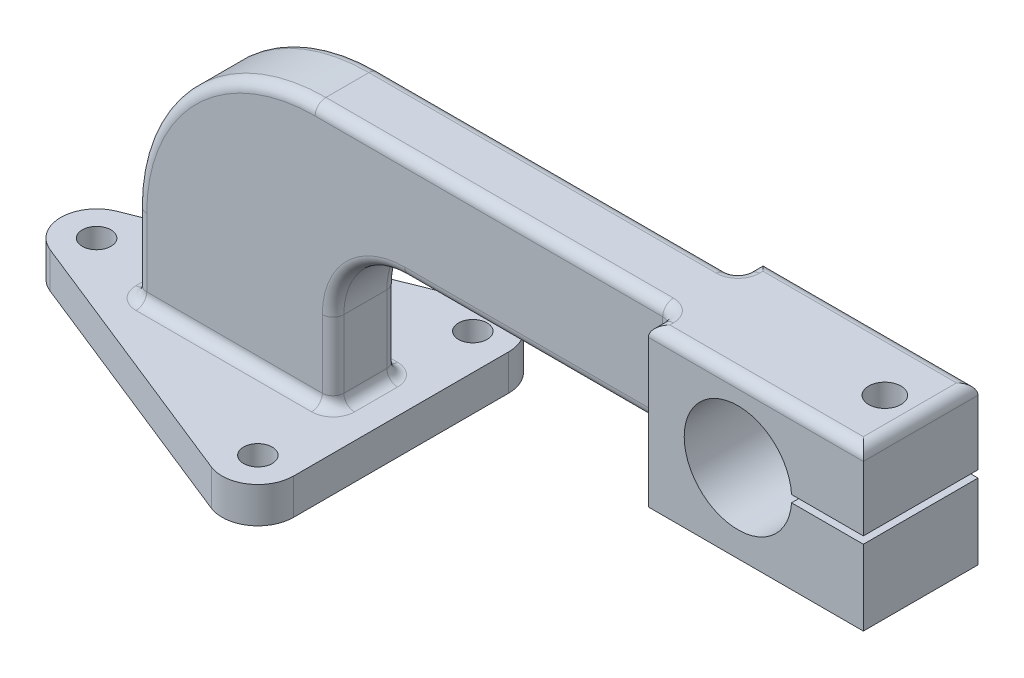
from build123d import *

# Parameters (mm, degrees)
BOSS_EXTRUDE1_DEPTH = 9
SKETCH3_R           = 4
SKETCH3_W           = 55
SKETCH3_H           = 18
BOSS_EXTRUDE2_DEPTH = 10
SKETCH4_W           = 32
SKETCH4_H           = 44
BOSS_EXTRUDE3_DEPTH = 60
SKETCH5_R           = 15
CUT_EXTRUDE1_DEPTH  = 60
SKETCH6_W           = 54.078900839
SKETCH6_H           = 2
CUT_EXTRUDE2_DEPTH  = 60
SKETCH7_R           = 4.5
CUT_EXTRUDE3_DEPTH  = 170.204757616
FILLET1_R           = 3


with BuildPart() as part:
    # Sketch1 → Boss-Extrude1 (new, symmetric)
    with BuildSketch(Plane.XY):
        with BuildLine():
            Line((-112.5, 7.686316473), (-57.5, 7.686316473))
            Line((-57.5, 7.686316473), (-57.5, 29.686316473))
            ThreePointArc((-57.5, 29.686316473), (-51.642135624, 43.828452097), (-37.5, 49.686316473))
            Line((-37.5, 49.686316473), (37.5, 49.686316473))
            Line((37.5, 49.686316473), (37.5, 79.686316473))
            Line((37.5, 79.686316473), (-62.5, 79.686316473))
            ThreePointArc((-62.5, 79.686316473), (-97.855339059, 65.041655533), (-112.5, 29.686316473))
            Line((-112.5, 29.686316473), (-112.5, 7.686316473))
        make_face()
    extrude(amount=BOSS_EXTRUDE1_DEPTH, both=True)

    # Sketch3 → Boss-Extrude2 (add)
    # profile 1 of 2: a face of its own
    with BuildSketch(Plane.XZ.offset(-7.686316473)):
        with BuildLine():
            ThreePointArc((-136.213906764, -9.284766909), (-142.5, 0), (-136.213906764, 9.284766909))
            Line((-136.213906764, 9.284766909), (-61.213906764, 39.284766909))
            ThreePointArc((-61.213906764, 39.284766909), (-51.893711907, 38.280672305), (-47.5, 30))
            Line((-47.5, 30), (-47.5, -30))
            ThreePointArc((-47.5, -30), (-51.893711907, -38.280672305), (-61.213906764, -39.284766909))
            Line((-61.213906764, -39.284766909), (-136.213906764, -9.284766909))
        make_face()
        with Locations(Location((-57.5, 30, 0), (0, 0, 270))):
            Circle(SKETCH3_R, mode=Mode.SUBTRACT)
        with Locations(Location((-57.5, -30, 0), (0, 0, 270))):
            Circle(SKETCH3_R, mode=Mode.SUBTRACT)
        with Locations(Location((-132.5, 0, 0), (0, 0, 270))):
            Circle(SKETCH3_R, mode=Mode.SUBTRACT)
        with Locations((-85, 0)):
            Rectangle(SKETCH3_W, SKETCH3_H, mode=Mode.SUBTRACT)
    # profile 2 of 2: a face of its own
    with BuildSketch(Plane.XZ.offset(-7.686316473)):
        with Locations((-85, 0)):
            Rectangle(SKETCH3_W, SKETCH3_H)
    extrude(amount=BOSS_EXTRUDE2_DEPTH)

    # Sketch4 → Boss-Extrude3 (add)
    with BuildSketch(Plane(origin=(37.5, 0, 0), x_dir=(0, 0, -1), z_dir=(1, 0, 0))):
        with Locations((0, 57.686316473)):
            Rectangle(SKETCH4_W, SKETCH4_H)
    extrude(amount=BOSS_EXTRUDE3_DEPTH)

    # Sketch5 → Cut-Extrude1 (cut)
    with BuildSketch(Plane.XY.offset(16)):
        with Locations((62.5, 57.686316473)):
            Circle(SKETCH5_R)
    extrude(amount=-CUT_EXTRUDE1_DEPTH, mode=Mode.SUBTRACT)

    # Sketch6 → Cut-Extrude2 (cut)
    with BuildSketch(Plane.XY.offset(16)):
        with Locations((94.351130384, 57.686316473)):
            Rectangle(SKETCH6_W, SKETCH6_H)
    extrude(amount=-CUT_EXTRUDE2_DEPTH, mode=Mode.SUBTRACT)

    # Sketch7 → Cut-Extrude3 (cut, through all)
    with BuildSketch(Plane(origin=(0, 79.686316473, 0), x_dir=(1, 0, 0), z_dir=(0, 1, 0))):
        with Locations(Location((87.5, 0, 0), (0, 0, 270))):
            Circle(SKETCH7_R)
    extrude(amount=-CUT_EXTRUDE3_DEPTH, mode=Mode.SUBTRACT)

    # Fillet1
    fillet1_edges = [part.edges().sort_by_distance(p)[0] for p in [
        (-57.5, 18.686316473, 9),
        (-85, 7.686316473, -9),
        (-112.5, 18.686316473, -9),
        (-51.642135624, 43.828452097, 9),
        (37.5, 49.686316473, 0),
        (-57.5, 7.686316473, 0),
        (-112.5, 7.686316473, 0),
        (0, 49.686316473, 9),
        (37.5, 64.686316473, 9),
        (-12.5, 79.686316473, 9),
        (-97.855339059, 65.041655533, 9),
        (-112.5, 18.686316473, 9),
        (97.5, 79.686316473, 0),
        (67.5, 79.686316473, -16),
        (67.5, 79.686316473, 16),
        (37.5, 79.686316473, -12.5),
        (37.5, 79.686316473, 12.5),
        (-85, 7.686316473, 9),
        (-97.855339059, 65.041655533, -9),
        (-12.5, 79.686316473, -9),
        (37.5, 64.686316473, -9),
        (0, 49.686316473, -9),
        (-51.642135624, 43.828452097, -9),
        (-57.5, 18.686316473, -9),
    ]]
    fillet(fillet1_edges, radius=FILLET1_R)


solid = part.part
